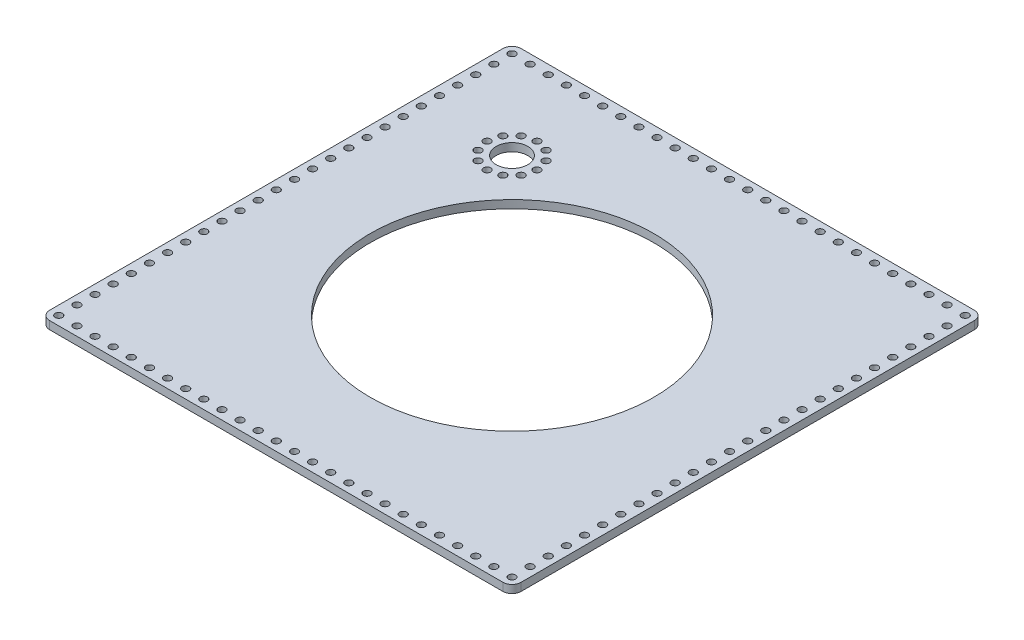
from build123d import *

# Parameters (mm, degrees)
SKETCH1_R           = 99.375000001
SKETCH1_R_2         = 2.5527
SKETCH1_R_3         = 11.1125
BOSS_EXTRUDE1_DEPTH = 5.588


with BuildPart() as part:
    # Sketch1 → Boss-Extrude1 (new body)
    with BuildSketch(Plane.XZ):
        with BuildLine():
            Line((-165.1, 158.75), (-165.1, -158.75))
            ThreePointArc((-165.1, -158.75), (-163.240128061, -163.240128061), (-158.75, -165.1))
            Line((-158.75, -165.1), (158.75, -165.1))
            ThreePointArc((158.75, -165.1), (163.240128061, -163.240128061), (165.1, -158.75))
            Line((165.1, -158.75), (165.1, 158.75))
            ThreePointArc((165.1, 158.75), (163.240128061, 163.240128061), (158.75, 165.1))
            Line((158.75, 165.1), (-158.75, 165.1))
            ThreePointArc((-158.75, 165.1), (-163.240128061, 163.240128061), (-165.1, 158.75))
        make_face()
        with Locations(Location((0, 0, 0), (0, 0, 90))):
            Circle(SKETCH1_R, mode=Mode.SUBTRACT)
        with Locations(Location((-158.75, -158.75, 0), (0, 0, 90))):
            Circle(SKETCH1_R_2, mode=Mode.SUBTRACT)
        with Locations(Location((-146.05, 158.75, 0), (0, 0, 90))):
            Circle(SKETCH1_R_2, mode=Mode.SUBTRACT)
        with Locations(Location((-133.35, 158.75, 0), (0, 0, 90))):
            Circle(SKETCH1_R_2, mode=Mode.SUBTRACT)
        with Locations(Location((-120.65, 158.75, 0), (0, 0, 90))):
            Circle(SKETCH1_R_2, mode=Mode.SUBTRACT)
        with Locations(Location((-107.95, 158.75, 0), (0, 0, 90))):
            Circle(SKETCH1_R_2, mode=Mode.SUBTRACT)
        with Locations(Location((-95.25, 158.75, 0), (0, 0, 90))):
            Circle(SKETCH1_R_2, mode=Mode.SUBTRACT)
        with Locations(Location((-82.55, 158.75, 0), (0, 0, 90))):
            Circle(SKETCH1_R_2, mode=Mode.SUBTRACT)
        with Locations(Location((-69.85, 158.75, 0), (0, 0, 90))):
            Circle(SKETCH1_R_2, mode=Mode.SUBTRACT)
        with Locations(Location((-57.15, 158.75, 0), (0, 0, 90))):
            Circle(SKETCH1_R_2, mode=Mode.SUBTRACT)
        with Locations(Location((-44.45, 158.75, 0), (0, 0, 90))):
            Circle(SKETCH1_R_2, mode=Mode.SUBTRACT)
        with Locations(Location((-31.75, 158.75, 0), (0, 0, 90))):
            Circle(SKETCH1_R_2, mode=Mode.SUBTRACT)
        with Locations(Location((-19.05, 158.75, 0), (0, 0, 90))):
            Circle(SKETCH1_R_2, mode=Mode.SUBTRACT)
        with Locations(Location((-6.35, 158.75, 0), (0, 0, 90))):
            Circle(SKETCH1_R_2, mode=Mode.SUBTRACT)
        with Locations(Location((6.35, 158.75, 0), (0, 0, 90))):
            Circle(SKETCH1_R_2, mode=Mode.SUBTRACT)
        with Locations(Location((19.05, 158.75, 0), (0, 0, 90))):
            Circle(SKETCH1_R_2, mode=Mode.SUBTRACT)
        with Locations(Location((31.75, 158.75, 0), (0, 0, 90))):
            Circle(SKETCH1_R_2, mode=Mode.SUBTRACT)
        with Locations(Location((44.45, 158.75, 0), (0, 0, 90))):
            Circle(SKETCH1_R_2, mode=Mode.SUBTRACT)
        with Locations(Location((57.15, 158.75, 0), (0, 0, 90))):
            Circle(SKETCH1_R_2, mode=Mode.SUBTRACT)
        with Locations(Location((69.85, 158.75, 0), (0, 0, 90))):
            Circle(SKETCH1_R_2, mode=Mode.SUBTRACT)
        with Locations(Location((82.55, 158.75, 0), (0, 0, 90))):
            Circle(SKETCH1_R_2, mode=Mode.SUBTRACT)
        with Locations(Location((95.25, 158.75, 0), (0, 0, 90))):
            Circle(SKETCH1_R_2, mode=Mode.SUBTRACT)
        with Locations(Location((107.95, 158.75, 0), (0, 0, 90))):
            Circle(SKETCH1_R_2, mode=Mode.SUBTRACT)
        with Locations(Location((120.65, 158.75, 0), (0, 0, 90))):
            Circle(SKETCH1_R_2, mode=Mode.SUBTRACT)
        with Locations(Location((-158.75, 158.75, 0), (0, 0, 90))):
            Circle(SKETCH1_R_2, mode=Mode.SUBTRACT)
        with Locations(Location((133.35, 158.75, 0), (0, 0, 90))):
            Circle(SKETCH1_R_2, mode=Mode.SUBTRACT)
        with Locations(Location((146.05, 158.75, 0), (0, 0, 90))):
            Circle(SKETCH1_R_2, mode=Mode.SUBTRACT)
        with Locations(Location((-158.75, 146.05, 0), (0, 0, 90))):
            Circle(SKETCH1_R_2, mode=Mode.SUBTRACT)
        with Locations(Location((158.75, 146.05, 0), (0, 0, 90))):
            Circle(SKETCH1_R_2, mode=Mode.SUBTRACT)
        with Locations(Location((-158.75, 133.35, 0), (0, 0, 90))):
            Circle(SKETCH1_R_2, mode=Mode.SUBTRACT)
        with Locations(Location((158.75, 133.35, 0), (0, 0, 90))):
            Circle(SKETCH1_R_2, mode=Mode.SUBTRACT)
        with Locations(Location((-158.75, 120.65, 0), (0, 0, 90))):
            Circle(SKETCH1_R_2, mode=Mode.SUBTRACT)
        with Locations(Location((158.75, 120.65, 0), (0, 0, 90))):
            Circle(SKETCH1_R_2, mode=Mode.SUBTRACT)
        with Locations(Location((-158.75, 107.95, 0), (0, 0, 90))):
            Circle(SKETCH1_R_2, mode=Mode.SUBTRACT)
        with Locations(Location((158.75, 107.95, 0), (0, 0, 90))):
            Circle(SKETCH1_R_2, mode=Mode.SUBTRACT)
        with Locations(Location((-158.75, 95.25, 0), (0, 0, 90))):
            Circle(SKETCH1_R_2, mode=Mode.SUBTRACT)
        with Locations(Location((158.75, 95.25, 0), (0, 0, 90))):
            Circle(SKETCH1_R_2, mode=Mode.SUBTRACT)
        with Locations(Location((-158.75, 82.55, 0), (0, 0, 90))):
            Circle(SKETCH1_R_2, mode=Mode.SUBTRACT)
        with Locations(Location((158.75, 82.55, 0), (0, 0, 90))):
            Circle(SKETCH1_R_2, mode=Mode.SUBTRACT)
        with Locations(Location((-158.75, 69.85, 0), (0, 0, 90))):
            Circle(SKETCH1_R_2, mode=Mode.SUBTRACT)
        with Locations(Location((158.75, 69.85, 0), (0, 0, 90))):
            Circle(SKETCH1_R_2, mode=Mode.SUBTRACT)
        with Locations(Location((-158.75, 57.15, 0), (0, 0, 90))):
            Circle(SKETCH1_R_2, mode=Mode.SUBTRACT)
        with Locations(Location((158.75, 57.15, 0), (0, 0, 90))):
            Circle(SKETCH1_R_2, mode=Mode.SUBTRACT)
        with Locations(Location((-158.75, 44.45, 0), (0, 0, 90))):
            Circle(SKETCH1_R_2, mode=Mode.SUBTRACT)
        with Locations(Location((158.75, 44.45, 0), (0, 0, 90))):
            Circle(SKETCH1_R_2, mode=Mode.SUBTRACT)
        with Locations(Location((-158.75, 31.75, 0), (0, 0, 90))):
            Circle(SKETCH1_R_2, mode=Mode.SUBTRACT)
        with Locations(Location((158.75, 158.75, 0), (0, 0, 90))):
            Circle(SKETCH1_R_2, mode=Mode.SUBTRACT)
        with Locations(Location((158.75, 31.75, 0), (0, 0, 90))):
            Circle(SKETCH1_R_2, mode=Mode.SUBTRACT)
        with Locations(Location((-158.75, 19.05, 0), (0, 0, 90))):
            Circle(SKETCH1_R_2, mode=Mode.SUBTRACT)
        with Locations(Location((158.75, 19.05, 0), (0, 0, 90))):
            Circle(SKETCH1_R_2, mode=Mode.SUBTRACT)
        with Locations(Location((-158.75, 6.35, 0), (0, 0, 90))):
            Circle(SKETCH1_R_2, mode=Mode.SUBTRACT)
        with Locations(Location((158.75, 6.35, 0), (0, 0, 90))):
            Circle(SKETCH1_R_2, mode=Mode.SUBTRACT)
        with Locations(Location((-158.75, -6.35, 0), (0, 0, 90))):
            Circle(SKETCH1_R_2, mode=Mode.SUBTRACT)
        with Locations(Location((158.75, -6.35, 0), (0, 0, 90))):
            Circle(SKETCH1_R_2, mode=Mode.SUBTRACT)
        with Locations(Location((-158.75, -19.05, 0), (0, 0, 90))):
            Circle(SKETCH1_R_2, mode=Mode.SUBTRACT)
        with Locations(Location((158.75, -19.05, 0), (0, 0, 90))):
            Circle(SKETCH1_R_2, mode=Mode.SUBTRACT)
        with Locations(Location((-158.75, -31.75, 0), (0, 0, 90))):
            Circle(SKETCH1_R_2, mode=Mode.SUBTRACT)
        with Locations(Location((158.75, -31.75, 0), (0, 0, 90))):
            Circle(SKETCH1_R_2, mode=Mode.SUBTRACT)
        with Locations(Location((-158.75, -44.45, 0), (0, 0, 90))):
            Circle(SKETCH1_R_2, mode=Mode.SUBTRACT)
        with Locations(Location((158.75, -44.45, 0), (0, 0, 90))):
            Circle(SKETCH1_R_2, mode=Mode.SUBTRACT)
        with Locations(Location((-158.75, -57.15, 0), (0, 0, 90))):
            Circle(SKETCH1_R_2, mode=Mode.SUBTRACT)
        with Locations(Location((158.75, -57.15, 0), (0, 0, 90))):
            Circle(SKETCH1_R_2, mode=Mode.SUBTRACT)
        with Locations(Location((-158.75, -69.85, 0), (0, 0, 90))):
            Circle(SKETCH1_R_2, mode=Mode.SUBTRACT)
        with Locations(Location((158.75, -69.85, 0), (0, 0, 90))):
            Circle(SKETCH1_R_2, mode=Mode.SUBTRACT)
        with Locations(Location((-158.75, -82.55, 0), (0, 0, 90))):
            Circle(SKETCH1_R_2, mode=Mode.SUBTRACT)
        with Locations(Location((158.75, -82.55, 0), (0, 0, 90))):
            Circle(SKETCH1_R_2, mode=Mode.SUBTRACT)
        with Locations(Location((-158.75, -95.25, 0), (0, 0, 90))):
            Circle(SKETCH1_R_2, mode=Mode.SUBTRACT)
        with Locations(Location((158.75, -95.25, 0), (0, 0, 90))):
            Circle(SKETCH1_R_2, mode=Mode.SUBTRACT)
        with Locations(Location((-158.75, -107.95, 0), (0, 0, 90))):
            Circle(SKETCH1_R_2, mode=Mode.SUBTRACT)
        with Locations(Location((158.75, -107.95, 0), (0, 0, 90))):
            Circle(SKETCH1_R_2, mode=Mode.SUBTRACT)
        with Locations(Location((-158.75, -120.65, 0), (0, 0, 90))):
            Circle(SKETCH1_R_2, mode=Mode.SUBTRACT)
        with Locations(Location((158.75, -120.65, 0), (0, 0, 90))):
            Circle(SKETCH1_R_2, mode=Mode.SUBTRACT)
        with Locations(Location((-158.75, -133.35, 0), (0, 0, 90))):
            Circle(SKETCH1_R_2, mode=Mode.SUBTRACT)
        with Locations(Location((158.75, -133.35, 0), (0, 0, 90))):
            Circle(SKETCH1_R_2, mode=Mode.SUBTRACT)
        with Locations(Location((-158.75, -146.05, 0), (0, 0, 90))):
            Circle(SKETCH1_R_2, mode=Mode.SUBTRACT)
        with Locations(Location((158.75, -146.05, 0), (0, 0, 90))):
            Circle(SKETCH1_R_2, mode=Mode.SUBTRACT)
        with Locations(Location((-146.05, -158.75, 0), (0, 0, 90))):
            Circle(SKETCH1_R_2, mode=Mode.SUBTRACT)
        with Locations(Location((-133.35, -158.75, 0), (0, 0, 90))):
            Circle(SKETCH1_R_2, mode=Mode.SUBTRACT)
        with Locations(Location((-120.65, -158.75, 0), (0, 0, 90))):
            Circle(SKETCH1_R_2, mode=Mode.SUBTRACT)
        with Locations(Location((-107.95, -158.75, 0), (0, 0, 90))):
            Circle(SKETCH1_R_2, mode=Mode.SUBTRACT)
        with Locations(Location((-95.25, -158.75, 0), (0, 0, 90))):
            Circle(SKETCH1_R_2, mode=Mode.SUBTRACT)
        with Locations(Location((-82.55, -158.75, 0), (0, 0, 90))):
            Circle(SKETCH1_R_2, mode=Mode.SUBTRACT)
        with Locations(Location((-69.85, -158.75, 0), (0, 0, 90))):
            Circle(SKETCH1_R_2, mode=Mode.SUBTRACT)
        with Locations(Location((-57.15, -158.75, 0), (0, 0, 90))):
            Circle(SKETCH1_R_2, mode=Mode.SUBTRACT)
        with Locations(Location((-44.45, -158.75, 0), (0, 0, 90))):
            Circle(SKETCH1_R_2, mode=Mode.SUBTRACT)
        with Locations(Location((-31.75, -158.75, 0), (0, 0, 90))):
            Circle(SKETCH1_R_2, mode=Mode.SUBTRACT)
        with Locations(Location((-19.05, -158.75, 0), (0, 0, 90))):
            Circle(SKETCH1_R_2, mode=Mode.SUBTRACT)
        with Locations(Location((-6.35, -158.75, 0), (0, 0, 90))):
            Circle(SKETCH1_R_2, mode=Mode.SUBTRACT)
        with Locations(Location((6.35, -158.75, 0), (0, 0, 90))):
            Circle(SKETCH1_R_2, mode=Mode.SUBTRACT)
        with Locations(Location((-96.986766108, -79.524266108, 0), (0, 0, 90))):
            Circle(SKETCH1_R_2, mode=Mode.SUBTRACT)
        with Locations(Location((19.05, -158.75, 0), (0, 0, 90))):
            Circle(SKETCH1_R_2, mode=Mode.SUBTRACT)
        with Locations(Location((31.75, -158.75, 0), (0, 0, 90))):
            Circle(SKETCH1_R_2, mode=Mode.SUBTRACT)
        with Locations(Location((44.45, -158.75, 0), (0, 0, 90))):
            Circle(SKETCH1_R_2, mode=Mode.SUBTRACT)
        with Locations(Location((57.15, -158.75, 0), (0, 0, 90))):
            Circle(SKETCH1_R_2, mode=Mode.SUBTRACT)
        with Locations(Location((69.85, -158.75, 0), (0, 0, 90))):
            Circle(SKETCH1_R_2, mode=Mode.SUBTRACT)
        with Locations(Location((82.55, -158.75, 0), (0, 0, 90))):
            Circle(SKETCH1_R_2, mode=Mode.SUBTRACT)
        with Locations(Location((95.25, -158.75, 0), (0, 0, 90))):
            Circle(SKETCH1_R_2, mode=Mode.SUBTRACT)
        with Locations(Location((107.95, -158.75, 0), (0, 0, 90))):
            Circle(SKETCH1_R_2, mode=Mode.SUBTRACT)
        with Locations(Location((120.65, -158.75, 0), (0, 0, 90))):
            Circle(SKETCH1_R_2, mode=Mode.SUBTRACT)
        with Locations(Location((133.35, -158.75, 0), (0, 0, 90))):
            Circle(SKETCH1_R_2, mode=Mode.SUBTRACT)
        with Locations(Location((146.05, -158.75, 0), (0, 0, 90))):
            Circle(SKETCH1_R_2, mode=Mode.SUBTRACT)
        with Locations(Location((158.75, -158.75, 0), (0, 0, 90))):
            Circle(SKETCH1_R_2, mode=Mode.SUBTRACT)
        with Locations(Location((-96.986766108, -96.986766108, 0), (0, 0, 270))):
            Circle(SKETCH1_R_3, mode=Mode.SUBTRACT)
        with Locations(Location((-88.255516108, -81.863797494, 0), (0, 0, 90))):
            Circle(SKETCH1_R_2, mode=Mode.SUBTRACT)
        with Locations(Location((-81.863797494, -88.255516108, 0), (0, 0, 90))):
            Circle(SKETCH1_R_2, mode=Mode.SUBTRACT)
        with Locations(Location((-79.524266108, -96.986766108, 0), (0, 0, 90))):
            Circle(SKETCH1_R_2, mode=Mode.SUBTRACT)
        with Locations(Location((-81.863797494, -105.718016108, 0), (0, 0, 90))):
            Circle(SKETCH1_R_2, mode=Mode.SUBTRACT)
        with Locations(Location((-88.255516108, -112.109734721, 0), (0, 0, 90))):
            Circle(SKETCH1_R_2, mode=Mode.SUBTRACT)
        with Locations(Location((-96.986766108, -114.449266108, 0), (0, 0, 90))):
            Circle(SKETCH1_R_2, mode=Mode.SUBTRACT)
        with Locations(Location((-105.718016108, -112.109734721, 0), (0, 0, 90))):
            Circle(SKETCH1_R_2, mode=Mode.SUBTRACT)
        with Locations(Location((-112.109734721, -105.718016108, 0), (0, 0, 90))):
            Circle(SKETCH1_R_2, mode=Mode.SUBTRACT)
        with Locations(Location((-114.449266108, -96.986766108, 0), (0, 0, 90))):
            Circle(SKETCH1_R_2, mode=Mode.SUBTRACT)
        with Locations(Location((-112.109734721, -88.255516108, 0), (0, 0, 90))):
            Circle(SKETCH1_R_2, mode=Mode.SUBTRACT)
        with Locations(Location((-105.718016108, -81.863797494, 0), (0, 0, 90))):
            Circle(SKETCH1_R_2, mode=Mode.SUBTRACT)
    extrude(amount=-BOSS_EXTRUDE1_DEPTH)


solid = part.part
